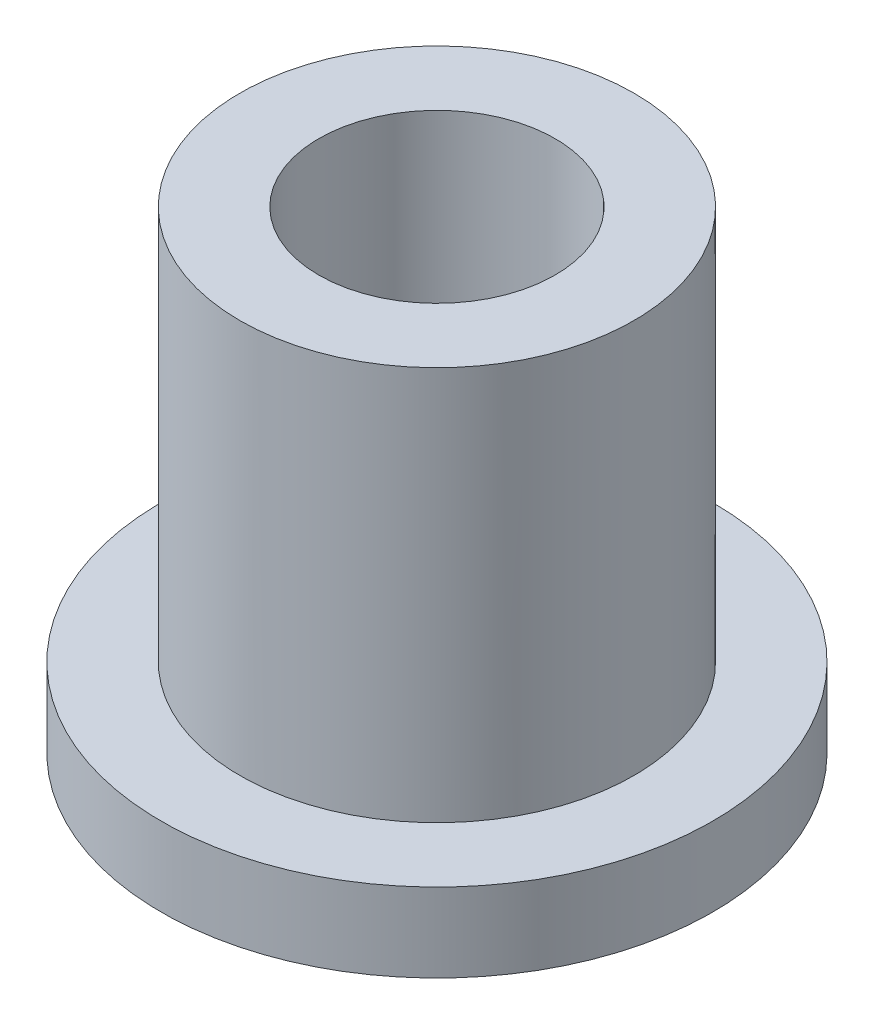
from build123d import *

# Parameters (mm, degrees)
SKETCH_1_R      = 5
SKETCH_1_R_2    = 3
EXTRUDE_1_DEPTH = 12
SKETCH_2_R      = 7
SKETCH_2_R_2    = 3
EXTRUDE_2_DEPTH = 2


with BuildPart() as part:
    # 草图1 → 凸台-拉伸1 (new body)
    with BuildSketch(Plane(origin=(0, 0, 0), x_dir=(1, 0, 0), z_dir=(0, 1, 0))):
        with Locations(Location((0, 0, 0), (0, 0, 270))):
            Circle(SKETCH_1_R)
        with Locations(Location((0, 0, 0), (0, 0, 270))):
            Circle(SKETCH_1_R_2, mode=Mode.SUBTRACT)
    extrude(amount=EXTRUDE_1_DEPTH)

    # 草图2 → 凸台-拉伸2 (add)
    with BuildSketch(Plane.XZ):
        with Locations(Location((0, 0, 0), (0, 0, 270))):
            Circle(SKETCH_2_R)
        with Locations(Location((0, 0, 0), (0, 0, 90))):
            Circle(SKETCH_2_R_2, mode=Mode.SUBTRACT)
    extrude(amount=-EXTRUDE_2_DEPTH)


solid = part.part
